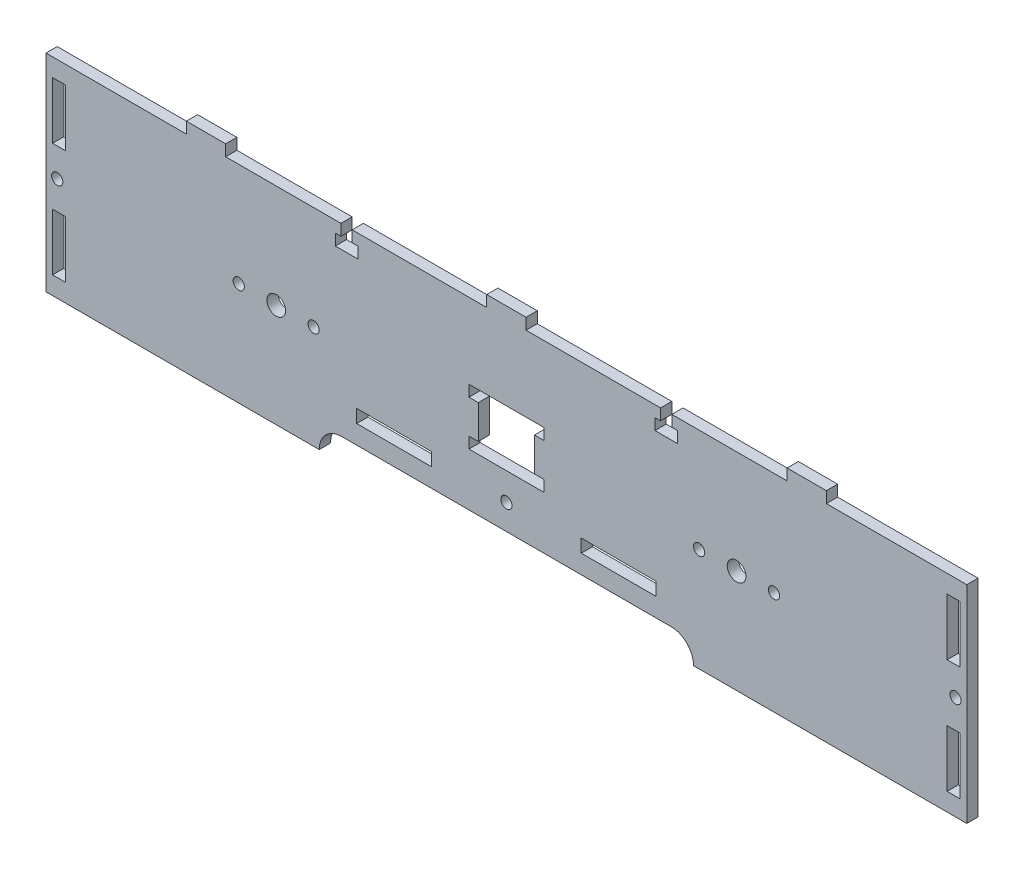
from build123d import *

# Parameters (mm, degrees)
CROQUIS1_R              = 2.5
CROQUIS1_R_2            = 1.5
CROQUIS1_W              = 20
CROQUIS1_H              = 3.5
CROQUIS1_W_2            = 3.5
CROQUIS1_H_2            = 15.2
SALIENTE_EXTRUIR1_DEPTH = 3
CROQUIS2_W              = 10.5
CROQUIS2_H              = 3
SALIENTE_EXTRUIR2_DEPTH = 3
CROQUIS3_R              = 1.5
CORTAR_EXTRUIR1_DEPTH   = 3
CROQUIS4_R              = 1.5
CORTAR_EXTRUIR2_DEPTH   = 3


with BuildPart() as part:
    # Croquis1 → Saliente-Extruir1 (new body)
    with BuildSketch(Plane.XY):
        with BuildLine():
            Line((123, -27.625), (50, -27.625))
            Line((50, -27.625), (50, -27.595))
            ThreePointArc((50, -27.595), (48.242640687, -23.352359313), (44, -21.595))
            Line((44, -21.595), (-44, -21.595))
            ThreePointArc((-44, -21.595), (-48.242640687, -23.352359313), (-50, -27.595))
            Line((-50, -27.595), (-50, -27.625))
            Line((-50, -27.625), (-123, -27.625))
            Line((-123, -27.625), (-123, 27.625))
            Line((-123, 27.625), (-44.2, 27.625))
            Line((-44.2, 27.625), (-44.2, 24.625))
            Line((-44.2, 24.625), (-45.7, 24.625))
            Line((-45.7, 24.625), (-45.7, 21.625))
            Line((-45.7, 21.625), (-39.7, 21.625))
            Line((-39.7, 21.625), (-39.7, 24.625))
            Line((-39.7, 24.625), (-41.2, 24.625))
            Line((-41.2, 24.625), (-41.2, 27.625))
            Line((-41.2, 27.625), (41.2, 27.625))
            Line((41.2, 27.625), (41.2, 24.625))
            Line((41.2, 24.625), (39.7, 24.625))
            Line((39.7, 24.625), (39.7, 21.625))
            Line((39.7, 21.625), (45.7, 21.625))
            Line((45.7, 21.625), (45.7, 24.625))
            Line((45.7, 24.625), (44.2, 24.625))
            Line((44.2, 24.625), (44.2, 27.625))
            Line((44.2, 27.625), (123, 27.625))
            Line((123, 27.625), (123, -27.625))
        make_face()
        with Locations((61.5, 0)):
            Circle(CROQUIS1_R, mode=Mode.SUBTRACT)
        with Locations((71.5, 0)):
            Circle(CROQUIS1_R_2, mode=Mode.SUBTRACT)
        with Locations((51.5, 0)):
            Circle(CROQUIS1_R_2, mode=Mode.SUBTRACT)
        with Locations((-71.5, 0)):
            Circle(CROQUIS1_R_2, mode=Mode.SUBTRACT)
        with Locations((-61.5, 0)):
            Circle(CROQUIS1_R, mode=Mode.SUBTRACT)
        with Locations((-51.5, 0)):
            Circle(CROQUIS1_R_2, mode=Mode.SUBTRACT)
        Polygon((-10, 7.5), (10, 7.5), (10, 4.5), (7.5, 4.5), (7.5, -4.5), (10, -4.5), (10, -7.5), (-10, -7.5), (-10, -4.5), (-7.5, -4.5), (-7.5, 4.5), (-10, 4.5), align=None, mode=Mode.SUBTRACT)
        with Locations((30, -14.845)):
            Rectangle(CROQUIS1_W, CROQUIS1_H, mode=Mode.SUBTRACT)
        with Locations((119.5, 15.225)):
            Rectangle(CROQUIS1_W_2, CROQUIS1_H_2, mode=Mode.SUBTRACT)
        with Locations((119.5, -15.225)):
            Rectangle(CROQUIS1_W_2, CROQUIS1_H_2, mode=Mode.SUBTRACT)
        with Locations((-119.5, 15.225)):
            Rectangle(CROQUIS1_W_2, CROQUIS1_H_2, mode=Mode.SUBTRACT)
        with Locations((-119.5, -15.225)):
            Rectangle(CROQUIS1_W_2, CROQUIS1_H_2, mode=Mode.SUBTRACT)
        with Locations((-30, -14.845)):
            Rectangle(CROQUIS1_W, CROQUIS1_H, mode=Mode.SUBTRACT)
    extrude(amount=SALIENTE_EXTRUIR1_DEPTH)

    # Croquis2 → Saliente-Extruir2 (add)
    with BuildSketch(Plane(origin=(0, 27.625, 0), x_dir=(1, 0, 0), z_dir=(0, 1, 0))):
        with Locations((0, -1.5)):
            Rectangle(CROQUIS2_W, CROQUIS2_H)
        with Locations((80.25, -1.5)):
            Rectangle(CROQUIS2_W, CROQUIS2_H)
        with Locations((-80.25, -1.5)):
            Rectangle(CROQUIS2_W, CROQUIS2_H)
    extrude(amount=SALIENTE_EXTRUIR2_DEPTH)

    # Croquis3 → Cortar-Extruir1 (cut)
    with BuildSketch(Plane.XY.offset(3)):
        with Locations((-120, 0)):
            Circle(CROQUIS3_R)
        with Locations(Location((120, 0, 0), (0, 0, 180))):
            Circle(CROQUIS3_R)
    extrude(amount=-CORTAR_EXTRUIR1_DEPTH, mode=Mode.SUBTRACT)

    # Croquis4 → Cortar-Extruir2 (cut)
    with BuildSketch(Plane.XY.offset(3)):
        with Locations((0, -14.845)):
            Circle(CROQUIS4_R)
    extrude(amount=-CORTAR_EXTRUIR2_DEPTH, mode=Mode.SUBTRACT)


solid = part.part
